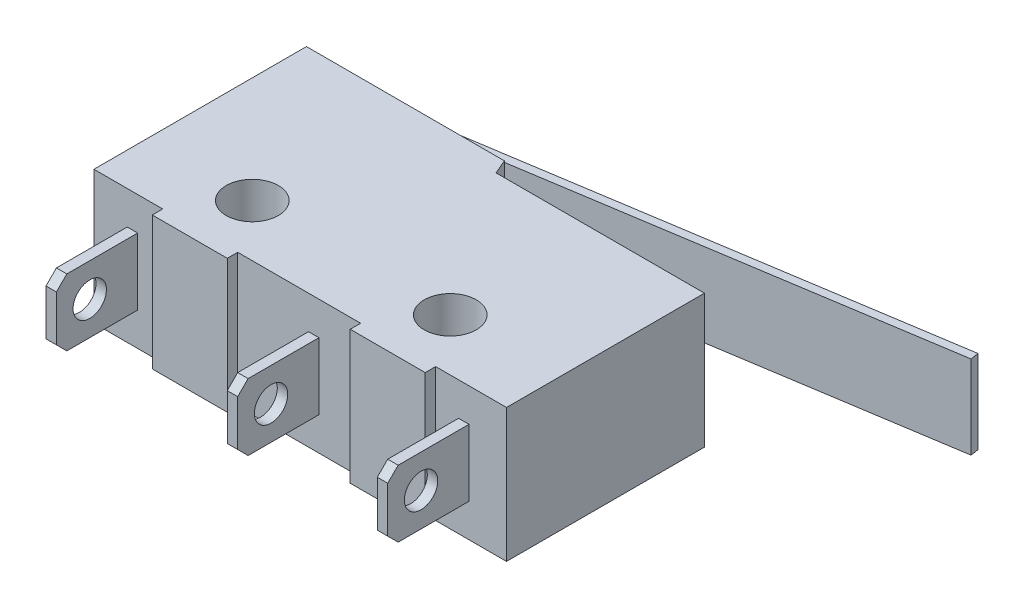
from build123d import *

# Parameters (mm, degrees)
EXTRUDE_1_DEPTH                        = 6.4
SKETCH_3_R                             = 1.25
CUT_EXTRUDE_1_DEPTH                    = 13.844454056
EXTRUDE_START                          = -1.6
SKETCH_4_W                             = 3.9
SKETCH_4_H                             = 3.2
SKETCH_4_R                             = 0.8
EXTRUDE_2_DEPTH                        = 0.5
CHAMFER_1_SIZE                         = 0.5
PATTERN_LINEAR_1_COUNT                 = 2
PATTERN_LINEAR_1_PITCH                 = 8.7
CHAMFER_1_OF_PATTERN_LINEAR_1_SIZE     = 0.5
PATTERN_LINEAR_1_COL_COUNT             = 2
PATTERN_LINEAR_1_COL_PITCH             = 15.9
CHAMFER_1_OF_PATTERN_LINEAR_1_COL_SIZE = 0.5
SKETCH_6_W                             = 0.4
SKETCH_6_H                             = 4
SKETCH_7_W                             = 3.6
SKETCH_7_H                             = 6.4
EXTRUDE_4_DEPTH                        = 0.5


with BuildPart() as part:
    # 草圖1 → 填料-伸長1 (new body)
    with BuildSketch(Plane(origin=(0, 0, 0), x_dir=(1, 0, 0), z_dir=(0, 1, 0))):
        Polygon((-0.4, 5.1), (-0.1, 4.4), (9.9, 4.4), (9.9, -5.1), (-9.9, -5.1), (-9.9, 5.1), align=None)
    extrude(amount=EXTRUDE_1_DEPTH)

    # 草圖3 → 除料-伸長1 (cut, through all)
    with BuildSketch(Plane(origin=(0, 6.4, 0), x_dir=(1, 0, 0), z_dir=(0, 1, 0))):
        with Locations((-4.8, -2.6)):
            Circle(SKETCH_3_R)
        with Locations((4.7, -2.6)):
            Circle(SKETCH_3_R)
    extrude(amount=-CUT_EXTRUDE_1_DEPTH, mode=Mode.SUBTRACT)

    # 草圖4 → 填料-伸長2 (add)
    with BuildSketch(Plane.ZY.offset(9.9).offset(EXTRUDE_START)):
        with Locations((7.05, 3.2)):
            Rectangle(SKETCH_4_W, SKETCH_4_H)
        with Locations((7.4, 3.2)):
            Circle(SKETCH_4_R, mode=Mode.SUBTRACT)
    extrude_2 = extrude(amount=-EXTRUDE_2_DEPTH)

    # 導角1
    chamfer_1_edges = [part.edges().sort_by_distance(p)[0] for p in [
        (-8.05, 1.6, 9),
        (-8.05, 4.8, 9),
    ]]
    chamfer(chamfer_1_edges, length=CHAMFER_1_SIZE)

    # 直線複製排列1: 填料-伸長2 ×2
    with Locations(*[(i * PATTERN_LINEAR_1_PITCH, 0, 0) for i in range(1, PATTERN_LINEAR_1_COUNT)]):
        add(extrude_2)

    # 導角1 of 直線複製排列1
    chamfer_1_of_pattern_linear_1_edges = [part.edges().sort_by_distance(p)[0] for p in [
        (0.65, 1.6, 9),
        (0.65, 4.8, 9),
    ]]
    chamfer(chamfer_1_of_pattern_linear_1_edges, length=CHAMFER_1_OF_PATTERN_LINEAR_1_SIZE)

    # 直線複製排列1 col: 填料-伸長2 ×2
    with Locations(*[(i * PATTERN_LINEAR_1_COL_PITCH, 0, 0) for i in range(1, PATTERN_LINEAR_1_COL_COUNT)]):
        add(extrude_2)

    # 導角1 of 直線複製排列1 col
    chamfer_1_of_pattern_linear_1_col_edges = [part.edges().sort_by_distance(p)[0] for p in [
        (7.85, 1.6, 9),
        (7.85, 4.8, 9),
    ]]
    chamfer(chamfer_1_of_pattern_linear_1_col_edges, length=CHAMFER_1_OF_PATTERN_LINEAR_1_COL_SIZE)

    # 掃出1: sweep along a path in 草圖5
    with BuildLine(Plane(origin=(0, 3.2, 0), x_dir=(1, 0, 0), z_dir=(0, 1, 0))) as sweep_1_path:
        Line((-6.9, 5.1), (-6.9, 5.6))
        Line((-6.9, 5.6), (17.8, 9.461346915))
    # 草圖6 → 掃出1 (sweep)
    with BuildSketch(Plane(origin=(0, 0, -5.1), x_dir=(-1, 0, 0), z_dir=(0, 0, -1))):
        with Locations((6.9, 3.2)):
            Rectangle(SKETCH_6_W, SKETCH_6_H)
    sweep(path=sweep_1_path.line, transition=Transition.RIGHT)

    # 草圖7 → 填料-伸長4 (add)
    with BuildSketch(Plane.XY.offset(5.1)):
        with Locations((-4.8, 3.2)):
            Rectangle(SKETCH_7_W, SKETCH_7_H)
        with Locations((4.7, 3.2)):
            Rectangle(SKETCH_7_W, SKETCH_7_H)
    extrude(amount=EXTRUDE_4_DEPTH)


solid = part.part
